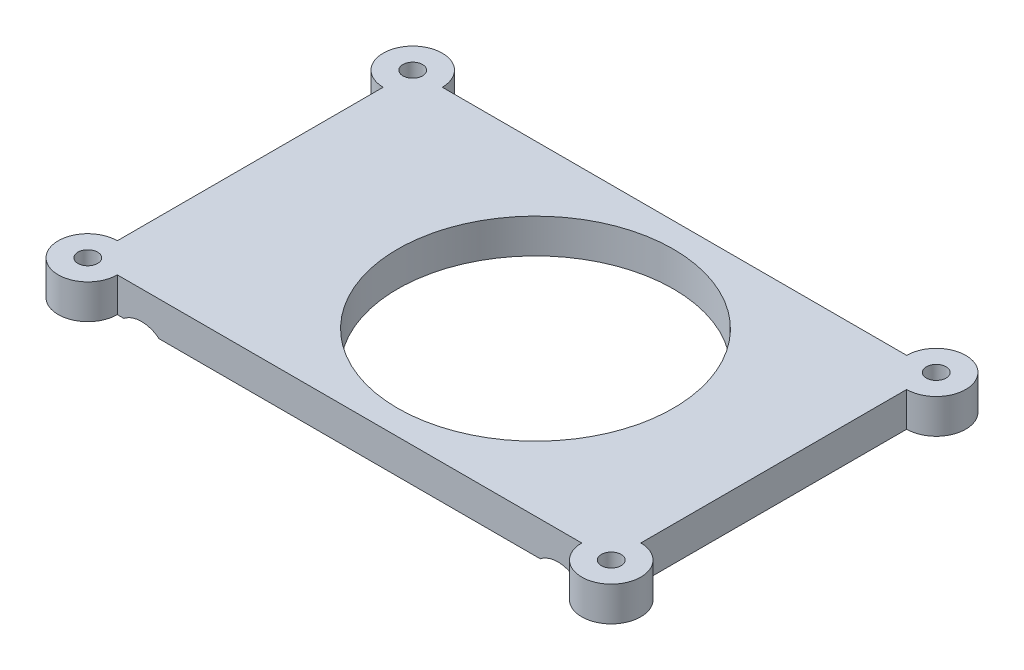
from build123d import *
from build123d.topology import SkipClean

# Parameters (mm, degrees)
SKETCH1_W               = 21.76
SKETCH1_H               = 66
SKETCH1_W_2             = 62.8
BOSS_EXTRUDE1_DEPTH     = 10
SKETCH1_5_W             = 62.8
SKETCH1_5_H             = 66
CUT_EXTRUDE1_DEPTH      = 5
SKETCH3_R               = 7.65
SKETCH3_R_2             = 5.75
CUT_EXTRUDE2_DEPTH      = 62
CUT_EXTRUDE3_DEPTH      = 84.797288739
CUT_EXTRUDE3_DEPTH_BACK = 84.797288739
SKETCH3_3_R             = 5.75
BOSS_EXTRUDE2_DEPTH     = 10
CUT_EXTRUDE4_DEPTH      = 72.560503073
SKETCH5_R               = 28
CUT_EXTRUDE5_DEPTH      = 72.560503073
BOSS_EXTRUDE3_DEPTH     = 5
CUT_EXTRUDE6_START      = -3
CUT_EXTRUDE6_DEPTH      = 3


with BuildPart() as part:
    # Sketch1 → Boss-Extrude1 (new body)
    with BuildSketch(Plane(origin=(0, 0, 0), x_dir=(1, 0, 0), z_dir=(0, 1, 0))):
        with Locations((-42.28, 0)):
            Rectangle(SKETCH1_W, SKETCH1_H)
        Rectangle(SKETCH1_W_2, SKETCH1_H)
        with Locations((42.28, 0)):
            Rectangle(SKETCH1_W, SKETCH1_H)
    extrude(amount=BOSS_EXTRUDE1_DEPTH)

    # Sketch1<5> → Cut-Extrude1 (cut)
    with BuildSketch(Plane(origin=(0, 0, 0), x_dir=(1, 0, 0), z_dir=(0, 1, 0))):
        Rectangle(SKETCH1_5_W, SKETCH1_5_H)
    extrude(amount=CUT_EXTRUDE1_DEPTH, mode=Mode.SUBTRACT)

    # Sketch3 → Cut-Extrude2 (cut)
    # profile 1 of 4: a face of its own
    with BuildSketch(Plane.XY.offset(31)):
        with Locations((-42.25, -4.5)):
            Circle(SKETCH3_R)
        with Locations((-42.25, -4.5)):
            Circle(SKETCH3_R_2, mode=Mode.SUBTRACT)
    # profile 2 of 4: a face of its own
    with BuildSketch(Plane.XY.offset(31)):
        with Locations((-42.25, -4.5)):
            Circle(SKETCH3_R_2)
    # profile 3 of 4: a face of its own
    with BuildSketch(Plane.XY.offset(31)):
        with Locations((42.31, -4.5)):
            Circle(SKETCH3_R)
        with Locations((42.31, -4.5)):
            Circle(SKETCH3_R_2, mode=Mode.SUBTRACT)
    # profile 4 of 4: a face of its own
    with BuildSketch(Plane.XY.offset(31)):
        with Locations((42.31, -4.5)):
            Circle(SKETCH3_R_2)
    extrude(amount=-CUT_EXTRUDE2_DEPTH, mode=Mode.SUBTRACT)

    # Sketch3<3> → Cut-Extrude3 (cut, two sides: drawn at the far end of the back side and taken through both)
    with BuildSketch(Plane.XY.offset(31).offset(-CUT_EXTRUDE3_DEPTH_BACK)):
        with Locations((42.31, -4.5)):
            Circle(SKETCH3_3_R)
        with Locations((-42.25, -4.5)):
            Circle(SKETCH3_3_R)
    extrude(amount=CUT_EXTRUDE3_DEPTH + CUT_EXTRUDE3_DEPTH_BACK, mode=Mode.SUBTRACT)

    # Sketch4 → Boss-Extrude2 (add)
    with BuildSketch(Plane.XZ):
        with BuildLine():
            Line((-51.16, 33), (-47.16, 33))
            ThreePointArc((-47.16, 33), (-57.402640687, 37.242640687), (-53.16, 27))
            Line((-53.16, 27), (-53.16, 31))
            ThreePointArc((-53.16, 31), (-54.574213562, 34.414213562), (-51.16, 33))
        make_face()
        with BuildLine():
            ThreePointArc((-53.16, -27), (-57.402640687, -37.242640687), (-47.16, -33))
            Line((-47.16, -33), (-51.16, -33))
            ThreePointArc((-51.16, -33), (-54.574213562, -34.414213562), (-53.16, -31))
            Line((-53.16, -31), (-53.16, -27))
        make_face()
        with BuildLine():
            ThreePointArc((47.16, -33), (57.402640687, -37.242640687), (53.16, -27))
            Line((53.16, -27), (53.16, -31))
            ThreePointArc((53.16, -31), (54.574213562, -34.414213562), (51.16, -33))
            Line((51.16, -33), (47.16, -33))
        make_face()
        with BuildLine():
            ThreePointArc((53.16, 27), (57.402640687, 37.242640687), (47.16, 33))
            Line((47.16, 33), (51.16, 33))
            ThreePointArc((51.16, 33), (54.574213562, 34.414213562), (53.16, 31))
            Line((53.16, 31), (53.16, 27))
        make_face()
    extrude(amount=-BOSS_EXTRUDE2_DEPTH)

    # Sketch4<3> → Cut-Extrude4 (cut, through all)
    with SkipClean():  # the faces are left unmerged after this step: merging them gives an invalid solid
        with BuildSketch(Plane.XZ):
            with BuildLine():
                ThreePointArc((51.16, 33), (51.745786438, 31.585786438), (53.16, 31))
                Line((53.16, 31), (53.16, 33))
                Line((53.16, 33), (51.16, 33))
            make_face()
            with BuildLine():
                Line((53.16, 33), (53.16, 31))
                ThreePointArc((53.16, 31), (54.574213562, 31.585786438), (55.16, 33))
                ThreePointArc((55.16, 33), (53.16, 35), (51.16, 33))
                Line((51.16, 33), (53.16, 33))
            make_face()
            with BuildLine():
                ThreePointArc((55.16, -33), (54.574213562, -31.585786438), (53.16, -31))
                Line((53.16, -31), (53.16, -33))
                Line((53.16, -33), (51.16, -33))
                ThreePointArc((51.16, -33), (53.16, -35), (55.16, -33))
            make_face()
            with BuildLine():
                Line((53.16, -33), (53.16, -31))
                ThreePointArc((53.16, -31), (51.745786438, -31.585786438), (51.16, -33))
                Line((51.16, -33), (53.16, -33))
            make_face()
            with BuildLine():
                ThreePointArc((-53.16, -31), (-54.574213562, -34.414213562), (-51.16, -33))
                Line((-51.16, -33), (-53.16, -33))
                Line((-53.16, -33), (-53.16, -31))
            make_face()
            with BuildLine():
                Line((-53.16, -33), (-51.16, -33))
                ThreePointArc((-51.16, -33), (-51.745786438, -31.585786438), (-53.16, -31))
                Line((-53.16, -31), (-53.16, -33))
            make_face()
            with BuildLine():
                ThreePointArc((-53.16, 31), (-51.745786438, 31.585786438), (-51.16, 33))
                Line((-51.16, 33), (-53.16, 33))
                Line((-53.16, 33), (-53.16, 31))
            make_face()
            with BuildLine():
                Line((-53.16, 33), (-51.16, 33))
                ThreePointArc((-51.16, 33), (-54.574213562, 34.414213562), (-53.16, 31))
                Line((-53.16, 31), (-53.16, 33))
            make_face()
        extrude(amount=-CUT_EXTRUDE4_DEPTH, mode=Mode.SUBTRACT)

    # Sketch5 → Cut-Extrude5 (cut, through all)
    with SkipClean():  # the faces are left unmerged after this step: merging them gives an invalid solid
        with BuildSketch(Plane(origin=(0, 10, 0), x_dir=(1, 0, 0), z_dir=(0, 1, 0))):
            with Locations(Location((4.77, 0, 0), (0, 0, 270))):
                Circle(SKETCH5_R)
        extrude(amount=-CUT_EXTRUDE5_DEPTH, mode=Mode.SUBTRACT)

    # Sketch6 → Boss-Extrude3 (add)
    with SkipClean():  # the faces are left unmerged after this step: merging them gives an invalid solid
        with BuildSketch(Plane.XZ.offset(-5)):
            with BuildLine():
                Line((31.4, -33), (31.4, -8.651190669))
                ThreePointArc((31.4, -8.651190669), (-23.23, 0), (31.4, 8.651190669))
                Line((31.4, 8.651190669), (31.4, 33))
                Line((31.4, 33), (-31.4, 33))
                Line((-31.4, 33), (-31.4, -33))
                Line((-31.4, -33), (31.4, -33))
            make_face()
        extrude(amount=BOSS_EXTRUDE3_DEPTH)

    # Sketch8 → Cut-Extrude6 (cut)
    with SkipClean():  # the faces are left unmerged after this step: merging them gives an invalid solid
        with BuildSketch(Plane(origin=(0, 10, 0), x_dir=(1, 0, 0), z_dir=(0, 1, 0)).offset(CUT_EXTRUDE6_START)):
            with BuildLine():
                Line((-53.16, 27), (-53.16, -27))
                ThreePointArc((-53.16, -27), (-57.402640687, -37.242640687), (-47.16, -33))
                Line((-47.16, -33), (47.16, -33))
                ThreePointArc((47.16, -33), (57.402640687, -37.242640687), (53.16, -27))
                Line((53.16, -27), (53.16, 27))
                ThreePointArc((53.16, 27), (57.402640687, 37.242640687), (47.16, 33))
                Line((47.16, 33), (-47.16, 33))
                ThreePointArc((-47.16, 33), (-57.402640687, 37.242640687), (-53.16, 27))
            make_face()
        extrude(amount=CUT_EXTRUDE6_DEPTH, mode=Mode.SUBTRACT)


solid = part.part
